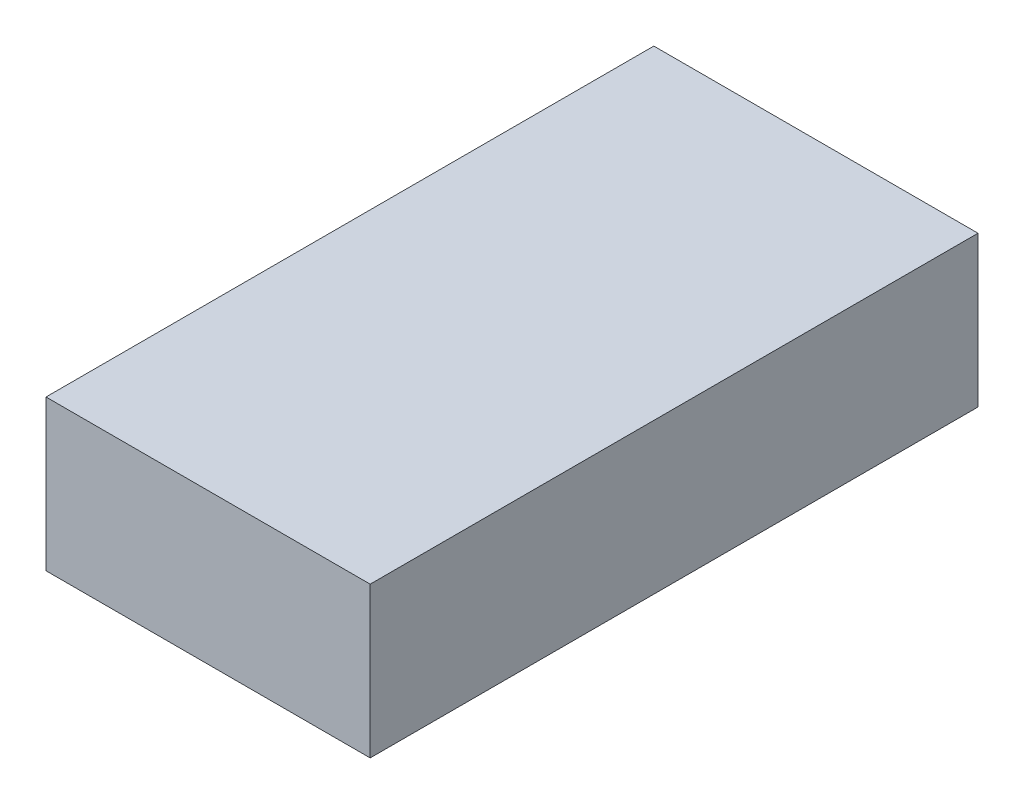
from build123d import *

# Parameters (mm, degrees)
IZIM1_W                     = 56
IZIM1_H                     = 26
Y_KSEKLIK_EKSTR_ZYON1_DEPTH = 105


with BuildPart() as part:
    # Çizim1 → Yükseklik-Ekstrüzyon1 (new body)
    with BuildSketch(Plane.XY):
        Rectangle(IZIM1_W, IZIM1_H)
    extrude(amount=Y_KSEKLIK_EKSTR_ZYON1_DEPTH)


solid = part.part
